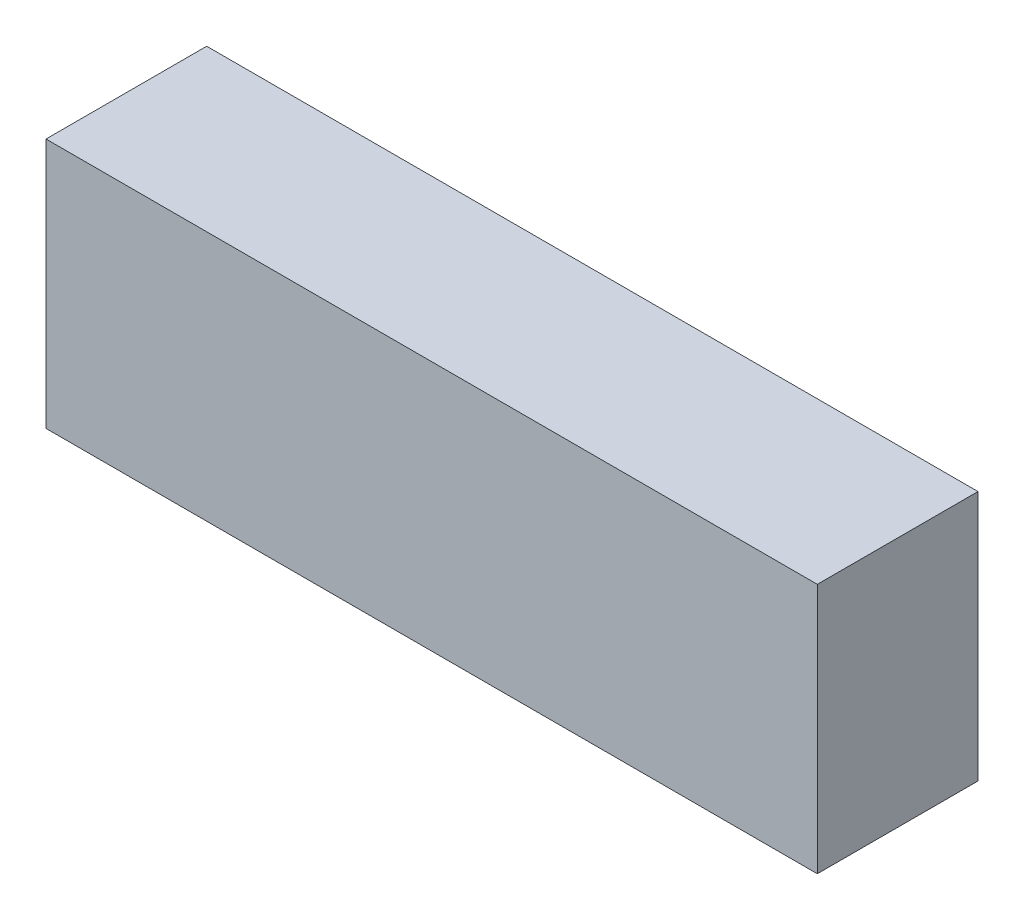
from build123d import *

# Parameters (mm, degrees)
SKETCH1_W           = 120
SKETCH1_H           = 25
BOSS_EXTRUDE1_DEPTH = 39


with BuildPart() as part:
    # Sketch1 → Boss-Extrude1 (new body)
    with BuildSketch(Plane(origin=(0, 0, 0), x_dir=(1, 0, 0), z_dir=(0, 1, 0))):
        Rectangle(SKETCH1_W, SKETCH1_H)
    extrude(amount=BOSS_EXTRUDE1_DEPTH)


solid = part.part
